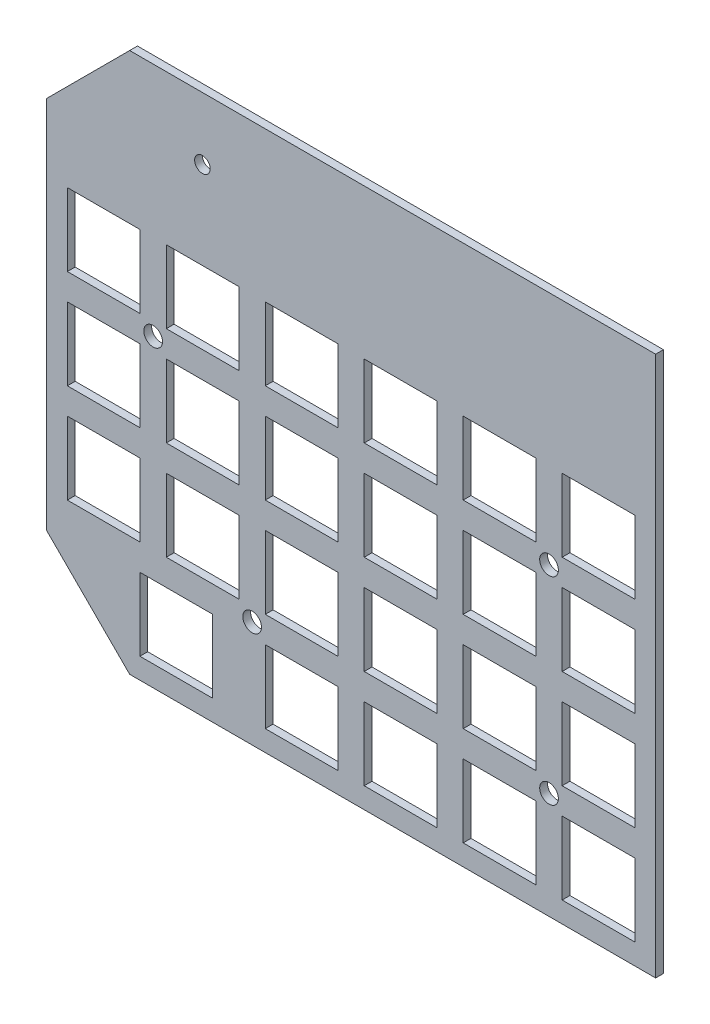
from build123d import *

# Parameters (mm, degrees)
BOSS_EXTRU_1_DEPTH      = 1.5
ESQUISSE2_R             = 1.5
ESQUISSE2_W             = 14
ESQUISSE2_H             = 14
ENL_V_MAT_EXTRU_1_DEPTH = 1.5
D_GAGEMENT_M31_D        = 3.6


with BuildPart() as part:
    # Esquisse1 → Boss.-Extru.1 (new body)
    with BuildSketch(Plane.XY):
        Polygon((0, -85), (16, -101), (117.25, -101), (117.25, 3), (16, 3), (0, -13), align=None)
    extrude(amount=BOSS_EXTRU_1_DEPTH)

    # Esquisse2 → Enlèv. mat.-Extru.1 (cut)
    with BuildSketch(Plane.XY.offset(1.5)):
        with Locations((30, -9)):
            Circle(ESQUISSE2_R)
        with Locations((11, -32.85)):
            Rectangle(ESQUISSE2_W, ESQUISSE2_H)
        with Locations((30.05, -32.85)):
            Rectangle(ESQUISSE2_W, ESQUISSE2_H)
        with Locations((49.1, -32.85)):
            Rectangle(ESQUISSE2_W, ESQUISSE2_H)
        with Locations((68.15, -32.85)):
            Rectangle(ESQUISSE2_W, ESQUISSE2_H)
        with Locations((87.2, -32.85)):
            Rectangle(ESQUISSE2_W, ESQUISSE2_H)
        with Locations((106.25, -32.85)):
            Rectangle(ESQUISSE2_W, ESQUISSE2_H)
        with Locations((30.05, -51.9)):
            Rectangle(ESQUISSE2_W, ESQUISSE2_H)
        with Locations((49.1, -51.9)):
            Rectangle(ESQUISSE2_W, ESQUISSE2_H)
        with Locations((68.15, -51.9)):
            Rectangle(ESQUISSE2_W, ESQUISSE2_H)
        with Locations((87.2, -51.9)):
            Rectangle(ESQUISSE2_W, ESQUISSE2_H)
        with Locations((106.25, -51.9)):
            Rectangle(ESQUISSE2_W, ESQUISSE2_H)
        with Locations((30.05, -70.95)):
            Rectangle(ESQUISSE2_W, ESQUISSE2_H)
        with Locations((49.1, -70.95)):
            Rectangle(ESQUISSE2_W, ESQUISSE2_H)
        with Locations((68.15, -70.95)):
            Rectangle(ESQUISSE2_W, ESQUISSE2_H)
        with Locations((87.2, -70.95)):
            Rectangle(ESQUISSE2_W, ESQUISSE2_H)
        with Locations((106.25, -70.95)):
            Rectangle(ESQUISSE2_W, ESQUISSE2_H)
        with Locations((11, -51.9)):
            Rectangle(ESQUISSE2_W, ESQUISSE2_H)
        with Locations((11, -70.95)):
            Rectangle(ESQUISSE2_W, ESQUISSE2_H)
        with Locations((49.1, -90)):
            Rectangle(ESQUISSE2_W, ESQUISSE2_H)
        with Locations((68.15, -90)):
            Rectangle(ESQUISSE2_W, ESQUISSE2_H)
        with Locations((87.2, -90)):
            Rectangle(ESQUISSE2_W, ESQUISSE2_H)
        with Locations((106.25, -90)):
            Rectangle(ESQUISSE2_W, ESQUISSE2_H)
        with Locations((24.97, -90)):
            Rectangle(ESQUISSE2_W, ESQUISSE2_H)
    extrude(amount=-ENL_V_MAT_EXTRU_1_DEPTH, mode=Mode.SUBTRACT)

    # Dégagement M31 (through all)
    with Locations(Plane.XY.offset(1.5)):
        with Locations((20.525, -42.375), (96.725, -42.375), (96.725, -80.475), (39.575, -80.475)):
            Hole(D_GAGEMENT_M31_D / 2)


solid = part.part
